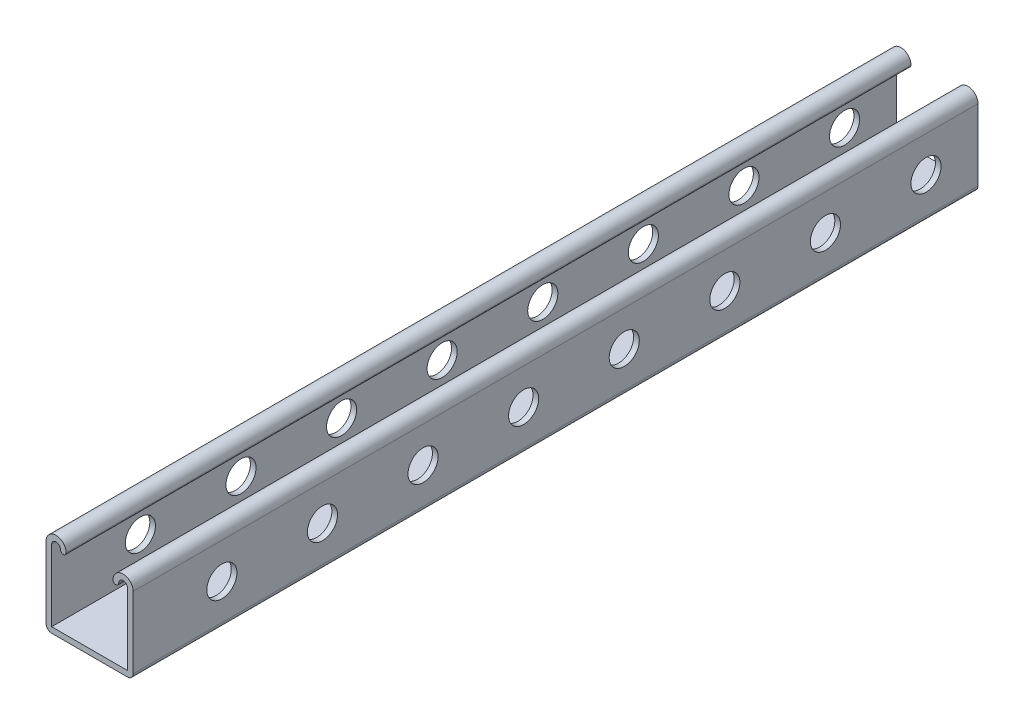
from build123d import *

# Parameters (mm, degrees)
EXTRUDE_1_DEPTH                     = 401.066
SKETCH_2_R                          = 7.1501
CUT_EXTRUDE_1_DEPTH                 = 5.08
PATTERN_LINEAR_1_COUNT              = 8
PATTERN_LINEAR_1_PITCH              = 47.752
PATTERN_CIRCULAR_2_COUNT            = 3
PATTERN_CIRCULAR_2_ANGLE            = 180
PATTERN_CIRCULAR_2_COPY_1_SKETCH_R  = 7.1501
PATTERN_CIRCULAR_2_COPY_1_DEPTH     = 5.08
PATTERN_CIRCULAR_2_COPY_2_SKETCH_R  = 7.1501
PATTERN_CIRCULAR_2_COPY_2_DEPTH     = 5.08
PATTERN_CIRCULAR_2_COPY_3_SKETCH_R  = 7.1501
PATTERN_CIRCULAR_2_COPY_3_DEPTH     = 5.08
PATTERN_CIRCULAR_2_COPY_4_SKETCH_R  = 7.1501
PATTERN_CIRCULAR_2_COPY_4_DEPTH     = 5.08
PATTERN_CIRCULAR_2_COPY_5_SKETCH_R  = 7.1501
PATTERN_CIRCULAR_2_COPY_5_DEPTH     = 5.08
PATTERN_CIRCULAR_2_COPY_6_SKETCH_R  = 7.1501
PATTERN_CIRCULAR_2_COPY_6_DEPTH     = 5.08
PATTERN_CIRCULAR_2_COPY_7_SKETCH_R  = 7.1501
PATTERN_CIRCULAR_2_COPY_7_DEPTH     = 5.08
PATTERN_CIRCULAR_2_COPY_8_SKETCH_R  = 7.1501
PATTERN_CIRCULAR_2_COPY_8_DEPTH     = 5.08
PATTERN_CIRCULAR_2_COPY_9_SKETCH_R  = 7.1501
PATTERN_CIRCULAR_2_COPY_9_DEPTH     = 5.08
PATTERN_CIRCULAR_2_COPY_10_SKETCH_R = 7.1501
PATTERN_CIRCULAR_2_COPY_10_DEPTH    = 5.08
PATTERN_CIRCULAR_2_COPY_11_SKETCH_R = 7.1501
PATTERN_CIRCULAR_2_COPY_11_DEPTH    = 5.08
PATTERN_CIRCULAR_2_COPY_12_SKETCH_R = 7.1501
PATTERN_CIRCULAR_2_COPY_12_DEPTH    = 5.08
PATTERN_CIRCULAR_2_COPY_13_SKETCH_R = 7.1501
PATTERN_CIRCULAR_2_COPY_13_DEPTH    = 5.08
PATTERN_CIRCULAR_2_COPY_14_SKETCH_R = 7.1501
PATTERN_CIRCULAR_2_COPY_14_DEPTH    = 5.08


with BuildPart() as part:
    # 草图1 → 凸台-拉伸1 (new body)
    with BuildSketch(Plane.XY):
        with BuildLine():
            Line((0, 0), (35.98, 0))
            ThreePointArc((35.98, 0), (37.883814298, 0.788585702), (38.6724, 2.6924))
            Line((38.6724, 2.6924), (38.6724, 36.5252))
            ThreePointArc((38.6724, 36.5252), (33.8972, 41.3004), (29.122, 36.5252))
            ThreePointArc((29.122, 36.5252), (30.4682, 35.179), (31.8144, 36.5252))
            ThreePointArc((31.8144, 36.5252), (33.8972, 38.608), (35.98, 36.5252))
            Line((35.98, 36.5252), (35.98, 2.6924))
            Line((35.98, 2.6924), (0, 2.6924))
            Line((0, 2.6924), (0, 36.5252))
            ThreePointArc((0, 36.5252), (2.0828, 38.608), (4.1656, 36.5252))
            ThreePointArc((4.1656, 36.5252), (5.5118, 35.179), (6.858, 36.5252))
            ThreePointArc((6.858, 36.5252), (2.0828, 41.3004), (-2.6924, 36.5252))
            Line((-2.6924, 36.5252), (-2.6924, 2.6924))
            ThreePointArc((-2.6924, 2.6924), (-1.903814298, 0.788585702), (0, 0))
        make_face()
    extrude(amount=EXTRUDE_1_DEPTH)

    # 草图2 → 切除-拉伸1 (cut)
    with BuildSketch(Plane.ZY.offset(2.6924)):
        with Locations((24.6761, 19.6088)):
            Circle(SKETCH_2_R)
    cut_extrude_1 = extrude(amount=-CUT_EXTRUDE_1_DEPTH, mode=Mode.SUBTRACT)

    # 阵列(线性)1: 切除-拉伸1 ×8
    with Locations(*[(0, 0, i * PATTERN_LINEAR_1_PITCH) for i in range(1, PATTERN_LINEAR_1_COUNT)]):
        add(cut_extrude_1, mode=Mode.SUBTRACT)

    # 阵列(圆周)2: 切除-拉伸1 ×3 about axis
    pattern_circular_2_axis = Axis((17.99, 19.6088, 0), (0, 0, 1))
    for i in range(1, PATTERN_CIRCULAR_2_COUNT):
        add(cut_extrude_1.rotate(pattern_circular_2_axis, i * PATTERN_CIRCULAR_2_ANGLE / (PATTERN_CIRCULAR_2_COUNT - 1)), mode=Mode.SUBTRACT)

    # 阵列(圆周)2 copy 1 sketch → 阵列(圆周)2 copy 1 (cut)
    with BuildSketch(Plane(origin=(37.5988, -1.0736, 47.752), x_dir=(0, 0, 1), z_dir=(0, -1, 0))):
        with Locations((24.6761, 19.6088)):
            Circle(PATTERN_CIRCULAR_2_COPY_1_SKETCH_R)
    extrude(amount=-PATTERN_CIRCULAR_2_COPY_1_DEPTH, mode=Mode.SUBTRACT)

    # 阵列(圆周)2 copy 2 sketch → 阵列(圆周)2 copy 2 (cut)
    with BuildSketch(Plane(origin=(38.6724, 39.2176, 47.752), x_dir=(0, 0, 1), z_dir=(1, 0, 0))):
        with Locations((24.6761, 19.6088)):
            Circle(PATTERN_CIRCULAR_2_COPY_2_SKETCH_R)
    extrude(amount=-PATTERN_CIRCULAR_2_COPY_2_DEPTH, mode=Mode.SUBTRACT)

    # 阵列(圆周)2 copy 3 sketch → 阵列(圆周)2 copy 3 (cut)
    with BuildSketch(Plane(origin=(37.5988, -1.0736, 95.504), x_dir=(0, 0, 1), z_dir=(0, -1, 0))):
        with Locations((24.6761, 19.6088)):
            Circle(PATTERN_CIRCULAR_2_COPY_3_SKETCH_R)
    extrude(amount=-PATTERN_CIRCULAR_2_COPY_3_DEPTH, mode=Mode.SUBTRACT)

    # 阵列(圆周)2 copy 4 sketch → 阵列(圆周)2 copy 4 (cut)
    with BuildSketch(Plane(origin=(38.6724, 39.2176, 95.504), x_dir=(0, 0, 1), z_dir=(1, 0, 0))):
        with Locations((24.6761, 19.6088)):
            Circle(PATTERN_CIRCULAR_2_COPY_4_SKETCH_R)
    extrude(amount=-PATTERN_CIRCULAR_2_COPY_4_DEPTH, mode=Mode.SUBTRACT)

    # 阵列(圆周)2 copy 5 sketch → 阵列(圆周)2 copy 5 (cut)
    with BuildSketch(Plane(origin=(37.5988, -1.0736, 143.256), x_dir=(0, 0, 1), z_dir=(0, -1, 0))):
        with Locations((24.6761, 19.6088)):
            Circle(PATTERN_CIRCULAR_2_COPY_5_SKETCH_R)
    extrude(amount=-PATTERN_CIRCULAR_2_COPY_5_DEPTH, mode=Mode.SUBTRACT)

    # 阵列(圆周)2 copy 6 sketch → 阵列(圆周)2 copy 6 (cut)
    with BuildSketch(Plane(origin=(38.6724, 39.2176, 143.256), x_dir=(0, 0, 1), z_dir=(1, 0, 0))):
        with Locations((24.6761, 19.6088)):
            Circle(PATTERN_CIRCULAR_2_COPY_6_SKETCH_R)
    extrude(amount=-PATTERN_CIRCULAR_2_COPY_6_DEPTH, mode=Mode.SUBTRACT)

    # 阵列(圆周)2 copy 7 sketch → 阵列(圆周)2 copy 7 (cut)
    with BuildSketch(Plane(origin=(37.5988, -1.0736, 191.008), x_dir=(0, 0, 1), z_dir=(0, -1, 0))):
        with Locations((24.6761, 19.6088)):
            Circle(PATTERN_CIRCULAR_2_COPY_7_SKETCH_R)
    extrude(amount=-PATTERN_CIRCULAR_2_COPY_7_DEPTH, mode=Mode.SUBTRACT)

    # 阵列(圆周)2 copy 8 sketch → 阵列(圆周)2 copy 8 (cut)
    with BuildSketch(Plane(origin=(38.6724, 39.2176, 191.008), x_dir=(0, 0, 1), z_dir=(1, 0, 0))):
        with Locations((24.6761, 19.6088)):
            Circle(PATTERN_CIRCULAR_2_COPY_8_SKETCH_R)
    extrude(amount=-PATTERN_CIRCULAR_2_COPY_8_DEPTH, mode=Mode.SUBTRACT)

    # 阵列(圆周)2 copy 9 sketch → 阵列(圆周)2 copy 9 (cut)
    with BuildSketch(Plane(origin=(37.5988, -1.0736, 238.76), x_dir=(0, 0, 1), z_dir=(0, -1, 0))):
        with Locations((24.6761, 19.6088)):
            Circle(PATTERN_CIRCULAR_2_COPY_9_SKETCH_R)
    extrude(amount=-PATTERN_CIRCULAR_2_COPY_9_DEPTH, mode=Mode.SUBTRACT)

    # 阵列(圆周)2 copy 10 sketch → 阵列(圆周)2 copy 10 (cut)
    with BuildSketch(Plane(origin=(38.6724, 39.2176, 238.76), x_dir=(0, 0, 1), z_dir=(1, 0, 0))):
        with Locations((24.6761, 19.6088)):
            Circle(PATTERN_CIRCULAR_2_COPY_10_SKETCH_R)
    extrude(amount=-PATTERN_CIRCULAR_2_COPY_10_DEPTH, mode=Mode.SUBTRACT)

    # 阵列(圆周)2 copy 11 sketch → 阵列(圆周)2 copy 11 (cut)
    with BuildSketch(Plane(origin=(37.5988, -1.0736, 286.512), x_dir=(0, 0, 1), z_dir=(0, -1, 0))):
        with Locations((24.6761, 19.6088)):
            Circle(PATTERN_CIRCULAR_2_COPY_11_SKETCH_R)
    extrude(amount=-PATTERN_CIRCULAR_2_COPY_11_DEPTH, mode=Mode.SUBTRACT)

    # 阵列(圆周)2 copy 12 sketch → 阵列(圆周)2 copy 12 (cut)
    with BuildSketch(Plane(origin=(38.6724, 39.2176, 286.512), x_dir=(0, 0, 1), z_dir=(1, 0, 0))):
        with Locations((24.6761, 19.6088)):
            Circle(PATTERN_CIRCULAR_2_COPY_12_SKETCH_R)
    extrude(amount=-PATTERN_CIRCULAR_2_COPY_12_DEPTH, mode=Mode.SUBTRACT)

    # 阵列(圆周)2 copy 13 sketch → 阵列(圆周)2 copy 13 (cut)
    with BuildSketch(Plane(origin=(37.5988, -1.0736, 334.264), x_dir=(0, 0, 1), z_dir=(0, -1, 0))):
        with Locations((24.6761, 19.6088)):
            Circle(PATTERN_CIRCULAR_2_COPY_13_SKETCH_R)
    extrude(amount=-PATTERN_CIRCULAR_2_COPY_13_DEPTH, mode=Mode.SUBTRACT)

    # 阵列(圆周)2 copy 14 sketch → 阵列(圆周)2 copy 14 (cut)
    with BuildSketch(Plane(origin=(38.6724, 39.2176, 334.264), x_dir=(0, 0, 1), z_dir=(1, 0, 0))):
        with Locations((24.6761, 19.6088)):
            Circle(PATTERN_CIRCULAR_2_COPY_14_SKETCH_R)
    extrude(amount=-PATTERN_CIRCULAR_2_COPY_14_DEPTH, mode=Mode.SUBTRACT)


solid = part.part
